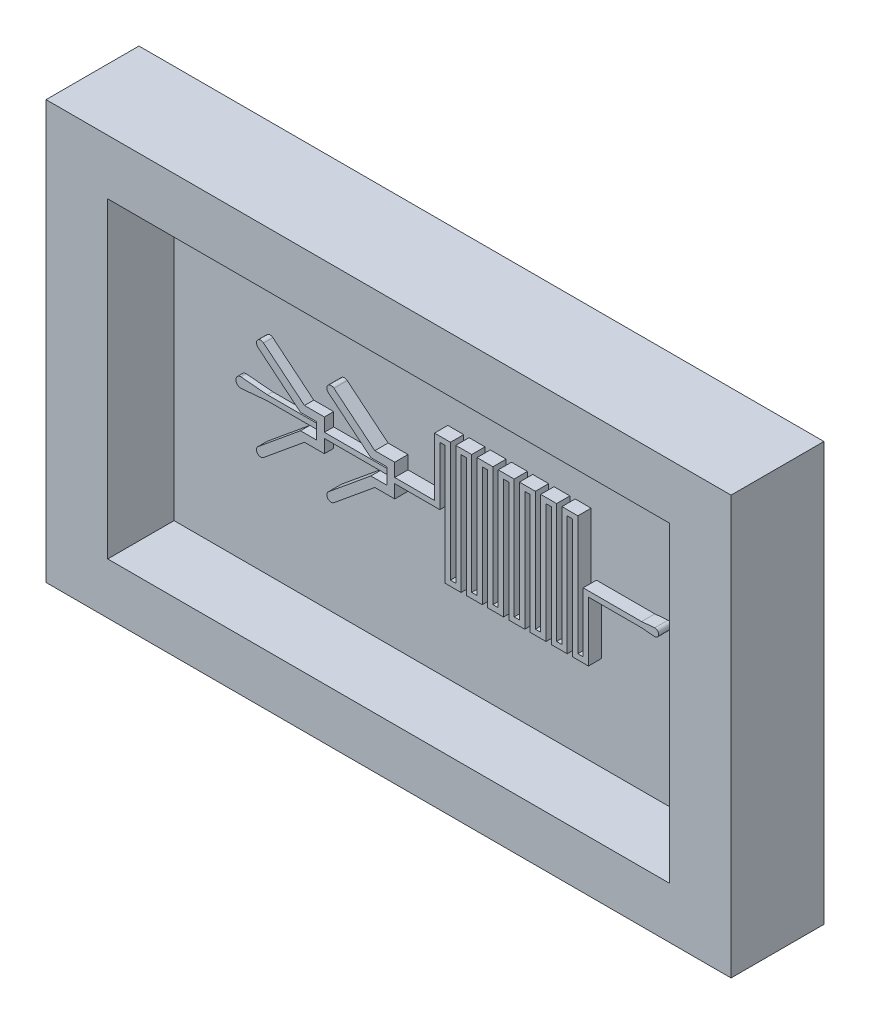
from build123d import *

# Parameters (mm, degrees)
BOSS_EXTRUDE4_DEPTH = 0.2
BOSS_EXTRUDE5_DEPTH = 0.35
BOSS_EXTRUDE6_DEPTH = 0.5
SKETCH5_W           = 21.158330311
SKETCH5_H           = 11.75153324
BOSS_EXTRUDE7_DEPTH = 1
SKETCH8_W           = 25.80987528
SKETCH8_H           = 15.757102731
SKETCH8_W_2         = 21.158330311
SKETCH8_H_2         = 11.75153324
BOSS_EXTRUDE8_DEPTH = 3.5


with BuildPart() as part:
    # Sketch1 → Boss-Extrude4 (new body)
    with BuildSketch(Plane.XY):
        with BuildLine():
            Line((-4.8, 0.09272626), (-5.796194698, 0.179882003))
            ThreePointArc((-5.796194698, 0.179882003), (-5.983350441, -0.00727374), (-5.796194698, -0.194429483))
            Line((-5.796194698, -0.194429483), (-4.8, -0.10727374))
            Line((-4.8, -0.10727374), (-2.8, -0.10727374))
            Line((-2.8, -0.10727374), (-2.8, 0.09272626))
            Line((-2.8, 0.09272626), (-4.8, 0.09272626))
        make_face()
    extrude(amount=BOSS_EXTRUDE4_DEPTH)

    # Sketch1<7> → Boss-Extrude5 (add)
    with BuildSketch(Plane.XY):
        with BuildLine():
            Line((-2.8, 0.29272626), (-2.8, 0.09272626))
            Line((-2.8, 0.09272626), (-2.8, -0.10727374))
            Line((-2.8, -0.10727374), (-2.8, -0.30727374))
            Line((-2.8, -0.30727374), (-3.4, -0.30727374))
            Line((-3.4, -0.30727374), (-4.999165526, -1.623297206))
            ThreePointArc((-4.999165526, -1.623297206), (-5.02151566, -1.853410903), (-4.791401964, -1.875761037))
            Line((-4.791401964, -1.875761037), (-3.25, -0.60727374))
            Line((-3.25, -0.60727374), (-2.5, -0.60727374))
            Line((-2.5, -0.60727374), (-2.5, -0.10727374))
            Line((-2.5, -0.10727374), (0, -0.10727374))
            Line((0, -0.10727374), (0, 0.09272626))
            Line((0, 0.09272626), (-2.5, 0.09272626))
            Line((-2.5, 0.09272626), (-2.5, 0.59272626))
            Line((-2.5, 0.59272626), (-3.25, 0.59272626))
            Line((-3.25, 0.59272626), (-4.791401964, 1.861213558))
            ThreePointArc((-4.791401964, 1.861213558), (-5.02151566, 1.838863423), (-4.999165526, 1.608749727))
            Line((-4.999165526, 1.608749727), (-3.4, 0.29272626))
            Line((-3.4, 0.29272626), (-2.8, 0.29272626))
        make_face()
    extrude(amount=BOSS_EXTRUDE5_DEPTH)

    # Sketch1<8> → Boss-Extrude6 (add)
    with BuildSketch(Plane.XY):
        with BuildLine():
            Line((0, 0.29272626), (0, -0.30727374))
            Line((0, -0.30727374), (-0.6, -0.30727374))
            Line((-0.6, -0.30727374), (-2.199165526, -1.623297206))
            ThreePointArc((-2.199165526, -1.623297206), (-2.22151566, -1.853410903), (-1.991401964, -1.875761037))
            Line((-1.991401964, -1.875761037), (-0.45, -0.60727374))
            Line((-0.45, -0.60727374), (0.3, -0.60727374))
            Line((0.3, -0.60727374), (0.3, -0.10727374))
            Line((0.3, -0.10727374), (2, -0.10727374))
            Line((2, -0.10727374), (2, 2.090619677))
            Line((2, 2.090619677), (2.2, 2.090619677))
            Line((2.2, 2.090619677), (2.2, -2.409380323))
            Line((2.2, -2.409380323), (2.8, -2.409380323))
            Line((2.8, -2.409380323), (2.8, 2.090619677))
            Line((2.8, 2.090619677), (3, 2.090619677))
            Line((3, 2.090619677), (3, -2.409380323))
            Line((3, -2.409380323), (3.6, -2.409380323))
            Line((3.6, -2.409380323), (3.6, 2.090619677))
            Line((3.6, 2.090619677), (3.8, 2.090619677))
            Line((3.8, 2.090619677), (3.8, -2.409380323))
            Line((3.8, -2.409380323), (4.4, -2.409380323))
            Line((4.4, -2.409380323), (4.4, 2.090619677))
            Line((4.4, 2.090619677), (4.6, 2.090619677))
            Line((4.6, 2.090619677), (4.6, -2.409380323))
            Line((4.6, -2.409380323), (5.2, -2.409380323))
            Line((5.2, -2.409380323), (5.2, 2.090619677))
            Line((5.2, 2.090619677), (5.4, 2.090619677))
            Line((5.4, 2.090619677), (5.4, -2.409380323))
            Line((5.4, -2.409380323), (6, -2.409380323))
            Line((6, -2.409380323), (6, 2.090619677))
            Line((6, 2.090619677), (6.2, 2.090619677))
            Line((6.2, 2.090619677), (6.2, -2.409380323))
            Line((6.2, -2.409380323), (6.8, -2.409380323))
            Line((6.8, -2.409380323), (6.8, 2.090619677))
            Line((6.8, 2.090619677), (7, 2.090619677))
            Line((7, 2.090619677), (7, -2.409380323))
            Line((7, -2.409380323), (7.6, -2.409380323))
            Line((7.6, -2.409380323), (7.6, -0.159380323))
            Line((7.6, -0.159380323), (9.6, -0.159380323))
            Line((9.6, -0.159380323), (10.098097349, -0.202958194))
            ThreePointArc((10.098097349, -0.202958194), (10.242728512, -0.058327031), (10.098097349, 0.086304132))
            Line((10.098097349, 0.086304132), (9.6, 0.04272626))
            Line((9.6, 0.04272626), (7.4, 0.04272626))
            Line((7.4, 0.04272626), (7.4, -2.20727374))
            Line((7.4, -2.20727374), (7.2, -2.20727374))
            Line((7.2, -2.20727374), (7.2, 2.29272626))
            Line((7.2, 2.29272626), (6.6, 2.29272626))
            Line((6.6, 2.29272626), (6.6, -2.20727374))
            Line((6.6, -2.20727374), (6.4, -2.20727374))
            Line((6.4, -2.20727374), (6.4, 2.29272626))
            Line((6.4, 2.29272626), (5.8, 2.29272626))
            Line((5.8, 2.29272626), (5.8, -2.20727374))
            Line((5.8, -2.20727374), (5.6, -2.20727374))
            Line((5.6, -2.20727374), (5.6, 2.29272626))
            Line((5.6, 2.29272626), (5, 2.29272626))
            Line((5, 2.29272626), (5, -2.20727374))
            Line((5, -2.20727374), (4.8, -2.20727374))
            Line((4.8, -2.20727374), (4.8, 2.29272626))
            Line((4.8, 2.29272626), (4.2, 2.29272626))
            Line((4.2, 2.29272626), (4.2, -2.20727374))
            Line((4.2, -2.20727374), (4, -2.20727374))
            Line((4, -2.20727374), (4, 2.29272626))
            Line((4, 2.29272626), (3.4, 2.29272626))
            Line((3.4, 2.29272626), (3.4, -2.20727374))
            Line((3.4, -2.20727374), (3.2, -2.20727374))
            Line((3.2, -2.20727374), (3.2, 2.29272626))
            Line((3.2, 2.29272626), (2.6, 2.29272626))
            Line((2.6, 2.29272626), (2.6, -2.20727374))
            Line((2.6, -2.20727374), (2.4, -2.20727374))
            Line((2.4, -2.20727374), (2.4, 2.29272626))
            Line((2.4, 2.29272626), (1.8, 2.29272626))
            Line((1.8, 2.29272626), (1.8, 0.09272626))
            Line((1.8, 0.09272626), (0.3, 0.09272626))
            Line((0.3, 0.09272626), (0.3, 0.59272626))
            Line((0.3, 0.59272626), (-0.45, 0.59272626))
            Line((-0.45, 0.59272626), (-1.991401964, 1.861213558))
            ThreePointArc((-1.991401964, 1.861213558), (-2.22151566, 1.838863423), (-2.199165526, 1.608749727))
            Line((-2.199165526, 1.608749727), (-0.6, 0.29272626))
            Line((-0.6, 0.29272626), (0, 0.29272626))
        make_face()
    extrude(amount=BOSS_EXTRUDE6_DEPTH)

    # Sketch5 → Boss-Extrude7 (add)
    with BuildSketch(Plane(origin=(0, 0, 0), x_dir=(-1, 0, 0), z_dir=(0, 0, -1))):
        with Locations((-2.065173388, -0.096435412)):
            Rectangle(SKETCH5_W, SKETCH5_H)
    extrude(amount=BOSS_EXTRUDE7_DEPTH)

    # Sketch8 → Boss-Extrude8 (add)
    with BuildSketch(Plane(origin=(0, 0, -1), x_dir=(-1, 0, 0), z_dir=(0, 0, -1))):
        with Locations((-2.067728751, -0.024369167)):
            Rectangle(SKETCH8_W, SKETCH8_H)
        with Locations((-2.065173388, -0.096435412)):
            Rectangle(SKETCH8_W_2, SKETCH8_H_2, mode=Mode.SUBTRACT)
    extrude(amount=-BOSS_EXTRUDE8_DEPTH)


solid = part.part
